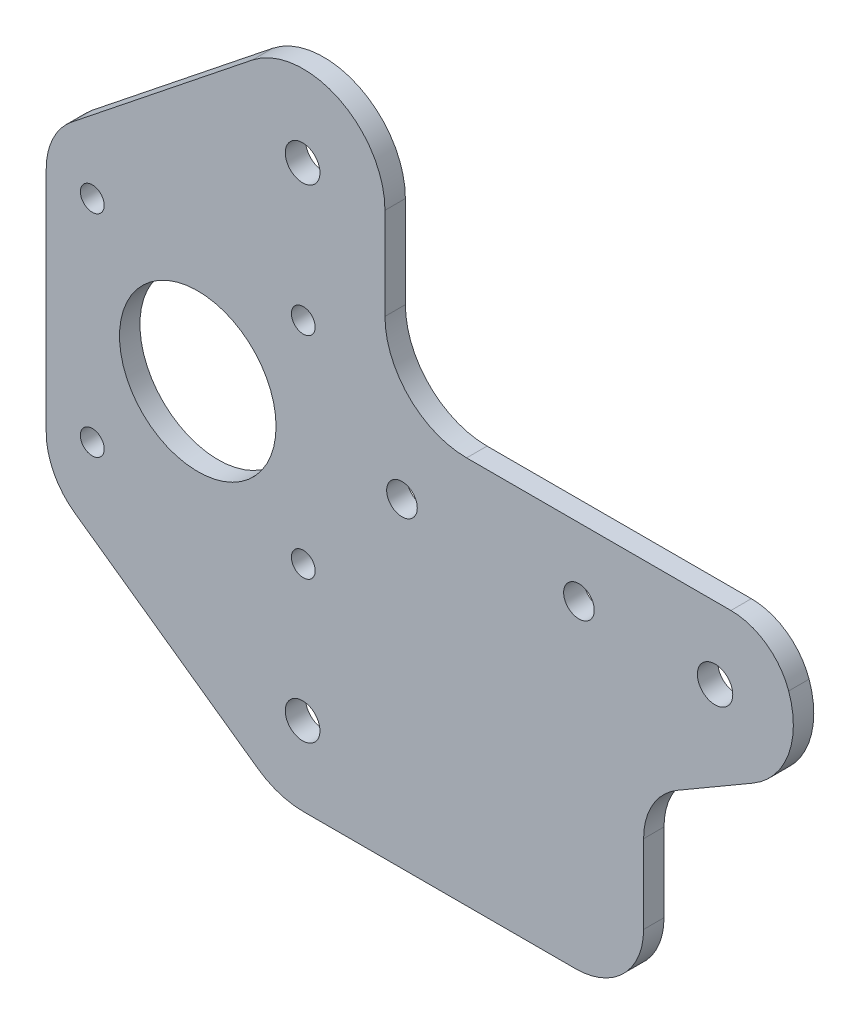
from build123d import *

# Parameters (mm, degrees)
CROQUIS1_R              = 2.25
CROQUIS1_R_2            = 2.55
CROQUIS1_R_3            = 1.75
CROQUIS1_R_4            = 11.5
CROQUIS1_R_5            = 2.6
SALIENTE_EXTRUIR1_DEPTH = 3


with BuildPart() as part:
    # Croquis1 → Saliente-Extruir1 (new body)
    with BuildSketch(Plane(origin=(0, 0, 0), x_dir=(-1, 0, 0), z_dir=(0, 0, -1))):
        with BuildLine():
            Line((-81.536322473, -10.37124925), (-70.469731273, -16.812277862))
            ThreePointArc((-70.469731273, -16.812277862), (-66.831012537, -20.470142908), (-65.5, -25.45498557))
            Line((-65.5, -25.45498557), (-65.5, -37))
            ThreePointArc((-65.5, -37), (-62.571067812, -44.071067812), (-55.5, -47))
            Line((-55.5, -47), (-15.5, -47))
            ThreePointArc((-15.5, -47), (-12.009499883, -46.45748187), (-8.848331869, -44.881114596))
            Line((-8.848331869, -44.881114596), (18.048253692, -25.81012264))
            ThreePointArc((18.048253692, -25.81012264), (21.147904046, -22.243895541), (22.264194447, -17.652631686))
            Line((22.264194447, -17.652631686), (22.264194447, 15.919671451))
            ThreePointArc((22.264194447, 15.919671451), (21.273744008, 20.258797712), (18.498591106, 23.738386071))
            Line((18.498591106, 23.738386071), (-8.01872401, 44.882457544))
            ThreePointArc((-8.01872401, 44.882457544), (-20.706951513, 46.311459473), (-27.5, 35.5))
            Line((-27.5, 35.5), (-27.5, 22))
            ThreePointArc((-27.5, 22), (-31.014718626, 13.514718626), (-39.5, 10))
            Line((-39.5, 10), (-78.328427125, 10))
            ThreePointArc((-78.328427125, 10), (-83.524579547, 8.348469228), (-86.813708499, 4))
            ThreePointArc((-86.813708499, 4), (-86.764505978, -4.136532977), (-81.536322473, -10.37124925))
        make_face()
        with Locations(Location((-30, 0, 0), (0, 0, 180))):
            Circle(CROQUIS1_R, mode=Mode.SUBTRACT)
        with Locations(Location((-15.4, -35.5, 0), (0, 0, 180))):
            Circle(CROQUIS1_R_2, mode=Mode.SUBTRACT)
        with Locations(Location((-15.4, 35.5, 0), (0, 0, 180))):
            Circle(CROQUIS1_R_2, mode=Mode.SUBTRACT)
        with Locations(Location((15.5, 15.5, 0), (0, 0, 180))):
            Circle(CROQUIS1_R_3, mode=Mode.SUBTRACT)
        with Locations(Location((15.5, -15.5, 0), (0, 0, 180))):
            Circle(CROQUIS1_R_3, mode=Mode.SUBTRACT)
        with Locations(Location((-15.5, -15.5, 0), (0, 0, 180))):
            Circle(CROQUIS1_R_3, mode=Mode.SUBTRACT)
        with Locations(Location((-15.5, 15.5, 0), (0, 0, 180))):
            Circle(CROQUIS1_R_3, mode=Mode.SUBTRACT)
        with Locations(Location((0, 0, 0), (0, 0, 180))):
            Circle(CROQUIS1_R_4, mode=Mode.SUBTRACT)
        with Locations(Location((-56, 0, 0), (0, 0, 180))):
            Circle(CROQUIS1_R, mode=Mode.SUBTRACT)
        with Locations(Location((-76, -0.574456265, 0), (0, 0, 180))):
            Circle(CROQUIS1_R_5, mode=Mode.SUBTRACT)
    extrude(amount=-SALIENTE_EXTRUIR1_DEPTH)


solid = part.part
